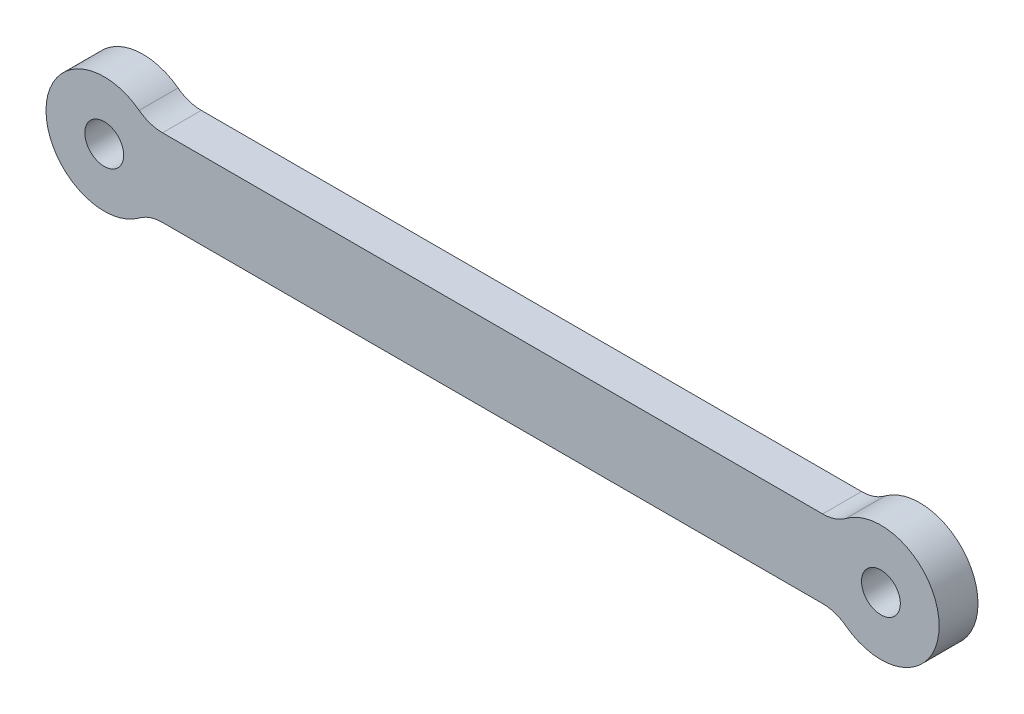
from build123d import *

# Parameters (mm, degrees)
SKETCH1_R           = 3.175
BOSS_EXTRUDE1_DEPTH = 3.175


with BuildPart() as part:
    # Sketch1 → Boss-Extrude1 (new, symmetric)
    with BuildSketch(Plane.XY):
        with BuildLine():
            Line((-117.475, 6.35), (-9.525, 6.35))
            ThreePointArc((-9.525, 6.35), (-7.516953686, 6.675861057), (-5.715, 7.62))
            ThreePointArc((-5.715, 7.62), (9.525, 0), (-5.715, -7.62))
            ThreePointArc((-5.715, -7.62), (-7.516953686, -6.675861057), (-9.525, -6.35))
            Line((-9.525, -6.35), (-117.475, -6.35))
            ThreePointArc((-117.475, -6.35), (-119.483046314, -6.675861057), (-121.285, -7.62))
            ThreePointArc((-121.285, -7.62), (-136.525, 0), (-121.285, 7.62))
            ThreePointArc((-121.285, 7.62), (-119.483046314, 6.675861057), (-117.475, 6.35))
        make_face()
        with Locations((-127, 0)):
            Circle(SKETCH1_R, mode=Mode.SUBTRACT)
        Circle(SKETCH1_R, mode=Mode.SUBTRACT)
    extrude(amount=BOSS_EXTRUDE1_DEPTH, both=True)


solid = part.part
